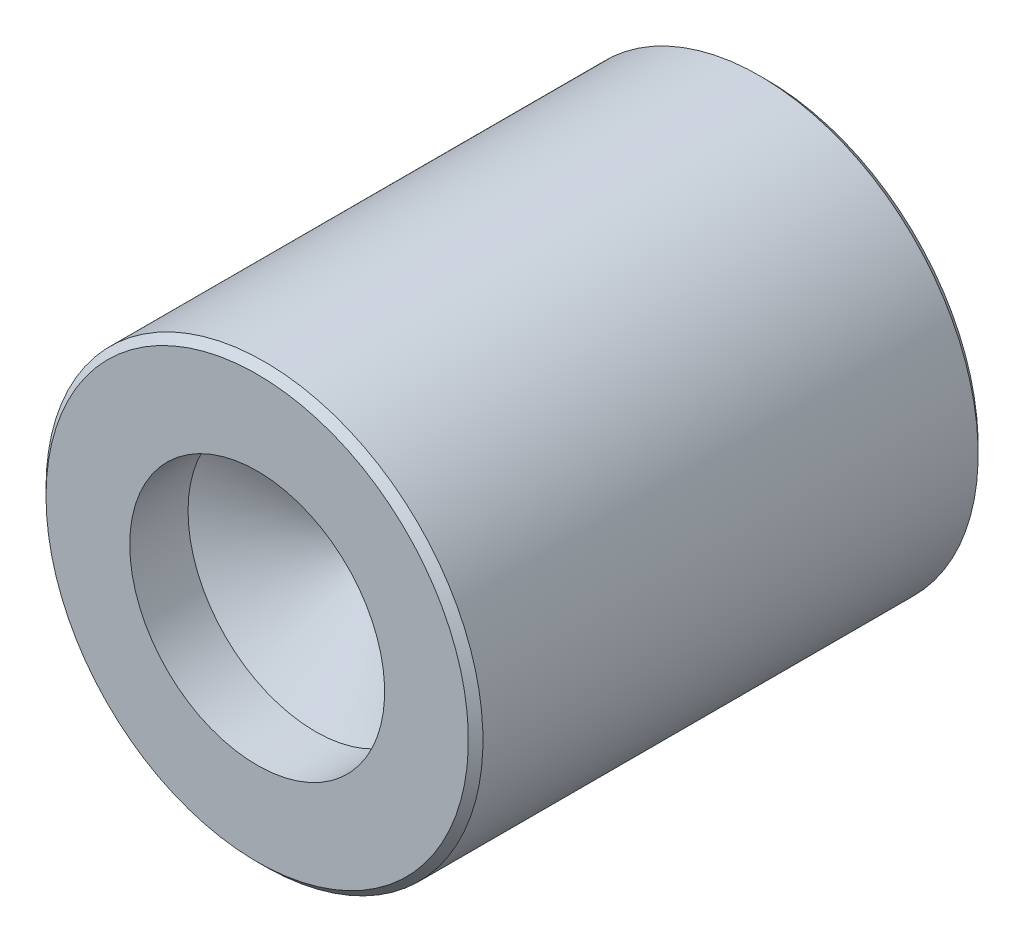
from build123d import *


with BuildPart() as part:
    # Esquisse1 → Révolution1 (revolve)
    with BuildSketch(Plane.XZ, mode=Mode.PRIVATE) as r_volution1_sk:
        Polygon((17.5, 62), (0, 51.484939167), (0, 0), (29, 0), (30, 1), (30, 69), (29, 70), (17.5, 70), align=None)
    revolve(r_volution1_sk.sketch.rotate(Axis((0, 0, 70), (0, 0, -1)), 180), axis=Axis((0, 0, 70), (0, 0, -1)))


solid = part.part
